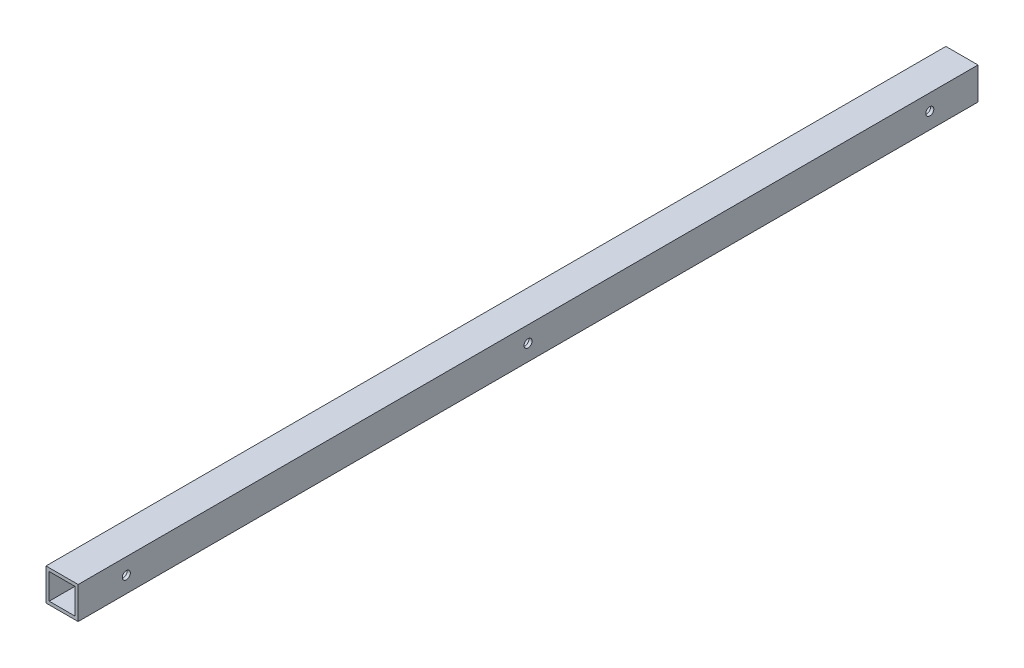
from build123d import *

# Parameters (mm, degrees)
SKETCH_1_W          = 20
SKETCH_1_H          = 20
SKETCH_1_W_2        = 16
SKETCH_1_H_2        = 16
EXTRUDE_1_DEPTH     = 560
SKETCH_2_R          = 2.5
CUT_EXTRUDE_1_DEPTH = 20


with BuildPart() as part:
    # 草图1 → 凸台-拉伸1 (new body)
    with BuildSketch(Plane.XY):
        Rectangle(SKETCH_1_W, SKETCH_1_H)
        Rectangle(SKETCH_1_W_2, SKETCH_1_H_2, mode=Mode.SUBTRACT)
    extrude(amount=-EXTRUDE_1_DEPTH)

    # 草图2 → 切除-拉伸1 (cut)
    with BuildSketch(Plane(origin=(10, 0, 0), x_dir=(0, 0, -1), z_dir=(1, 0, 0))):
        with Locations((280, 0)):
            Circle(SKETCH_2_R)
        with Locations((30, 0)):
            Circle(SKETCH_2_R)
        with Locations((530, 0)):
            Circle(SKETCH_2_R)
    extrude(amount=-CUT_EXTRUDE_1_DEPTH, mode=Mode.SUBTRACT)


solid = part.part
